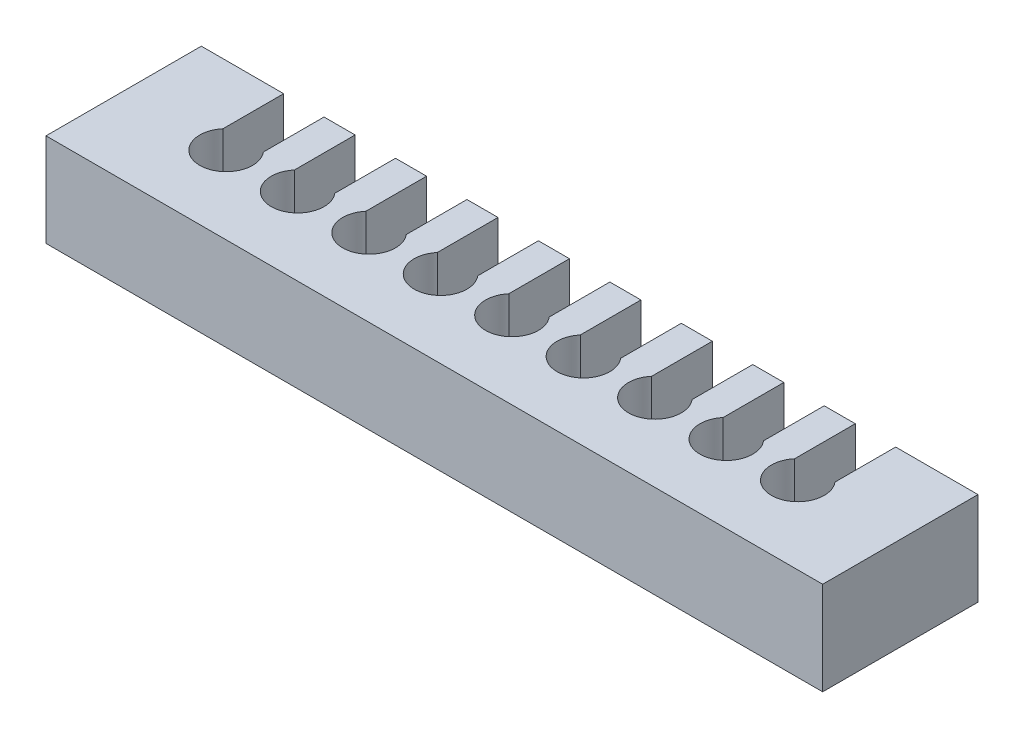
from build123d import *

# Parameters (mm, degrees)
CROQUIS1_W              = 25
CROQUIS1_H              = 5
SALIENTE_EXTRUIR1_DEPTH = 3
CORTAR_EXTRUIR6_DEPTH   = 3
MATRIZL4_COUNT          = 5
MATRIZL4_PITCH          = 2.3
SIMETR_A3_COPY_1_DEPTH  = 3
SIMETR_A3_COPY_2_DEPTH  = 3
SIMETR_A3_COPY_3_DEPTH  = 3
SIMETR_A3_COPY_4_DEPTH  = 3
SIMETR_A3_COPY_5_DEPTH  = 3


with BuildPart() as part:
    # Croquis1 → Saliente-Extruir1 (new body)
    with BuildSketch(Plane(origin=(0, 0, 0), x_dir=(1, 0, 0), z_dir=(0, 1, 0))):
        Rectangle(CROQUIS1_W, CROQUIS1_H)
    extrude(amount=SALIENTE_EXTRUIR1_DEPTH)

    # Croquis2 → Cortar-Extruir6 (cut)
    with BuildSketch(Plane(origin=(0, 3, 0), x_dir=(1, 0, 0), z_dir=(0, 1, 0))):
        with BuildLine():
            Line((0.65, 0.547722558), (0.65, 2.5))
            Line((0.65, 2.5), (-0.65, 2.5))
            Line((-0.65, 2.5), (-0.65, 0.547722558))
            ThreePointArc((-0.65, 0.547722558), (0, -0.85), (0.65, 0.547722558))
        make_face()
    cortar_extruir6 = extrude(amount=-CORTAR_EXTRUIR6_DEPTH, mode=Mode.SUBTRACT)

    # MatrizL4: Cortar-Extruir6 ×5
    with Locations(*[(i * MATRIZL4_PITCH, 0, 0) for i in range(1, MATRIZL4_COUNT)]):
        add(cortar_extruir6, mode=Mode.SUBTRACT)

    # Simetría3 copy 1 sketch → Simetría3 copy 1 (cut)
    with BuildSketch(Plane(origin=(-2.3, 3, 0), x_dir=(-1, 0, 0), z_dir=(0, 1, 0))):
        with BuildLine():
            Line((0.65, -0.547722558), (0.65, -2.5))
            Line((0.65, -2.5), (-0.65, -2.5))
            Line((-0.65, -2.5), (-0.65, -0.547722558))
            ThreePointArc((-0.65, -0.547722558), (0, 0.85), (0.65, -0.547722558))
        make_face()
    extrude(amount=-SIMETR_A3_COPY_1_DEPTH, mode=Mode.SUBTRACT)

    # Simetría3 copy 2 sketch → Simetría3 copy 2 (cut)
    with BuildSketch(Plane(origin=(-4.6, 3, 0), x_dir=(-1, 0, 0), z_dir=(0, 1, 0))):
        with BuildLine():
            Line((0.65, -0.547722558), (0.65, -2.5))
            Line((0.65, -2.5), (-0.65, -2.5))
            Line((-0.65, -2.5), (-0.65, -0.547722558))
            ThreePointArc((-0.65, -0.547722558), (0, 0.85), (0.65, -0.547722558))
        make_face()
    extrude(amount=-SIMETR_A3_COPY_2_DEPTH, mode=Mode.SUBTRACT)

    # Simetría3 copy 3 sketch → Simetría3 copy 3 (cut)
    with BuildSketch(Plane(origin=(-6.9, 3, 0), x_dir=(-1, 0, 0), z_dir=(0, 1, 0))):
        with BuildLine():
            Line((0.65, -0.547722558), (0.65, -2.5))
            Line((0.65, -2.5), (-0.65, -2.5))
            Line((-0.65, -2.5), (-0.65, -0.547722558))
            ThreePointArc((-0.65, -0.547722558), (0, 0.85), (0.65, -0.547722558))
        make_face()
    extrude(amount=-SIMETR_A3_COPY_3_DEPTH, mode=Mode.SUBTRACT)

    # Simetría3 copy 4 sketch → Simetría3 copy 4 (cut)
    with BuildSketch(Plane(origin=(-9.2, 3, 0), x_dir=(-1, 0, 0), z_dir=(0, 1, 0))):
        with BuildLine():
            Line((0.65, -0.547722558), (0.65, -2.5))
            Line((0.65, -2.5), (-0.65, -2.5))
            Line((-0.65, -2.5), (-0.65, -0.547722558))
            ThreePointArc((-0.65, -0.547722558), (0, 0.85), (0.65, -0.547722558))
        make_face()
    extrude(amount=-SIMETR_A3_COPY_4_DEPTH, mode=Mode.SUBTRACT)

    # Simetría3 copy 5 sketch → Simetría3 copy 5 (cut)
    with BuildSketch(Plane(origin=(0, 3, 0), x_dir=(-1, 0, 0), z_dir=(0, 1, 0))):
        with BuildLine():
            Line((0.65, -0.547722558), (0.65, -2.5))
            Line((0.65, -2.5), (-0.65, -2.5))
            Line((-0.65, -2.5), (-0.65, -0.547722558))
            ThreePointArc((-0.65, -0.547722558), (0, 0.85), (0.65, -0.547722558))
        make_face()
    extrude(amount=-SIMETR_A3_COPY_5_DEPTH, mode=Mode.SUBTRACT)


solid = part.part
